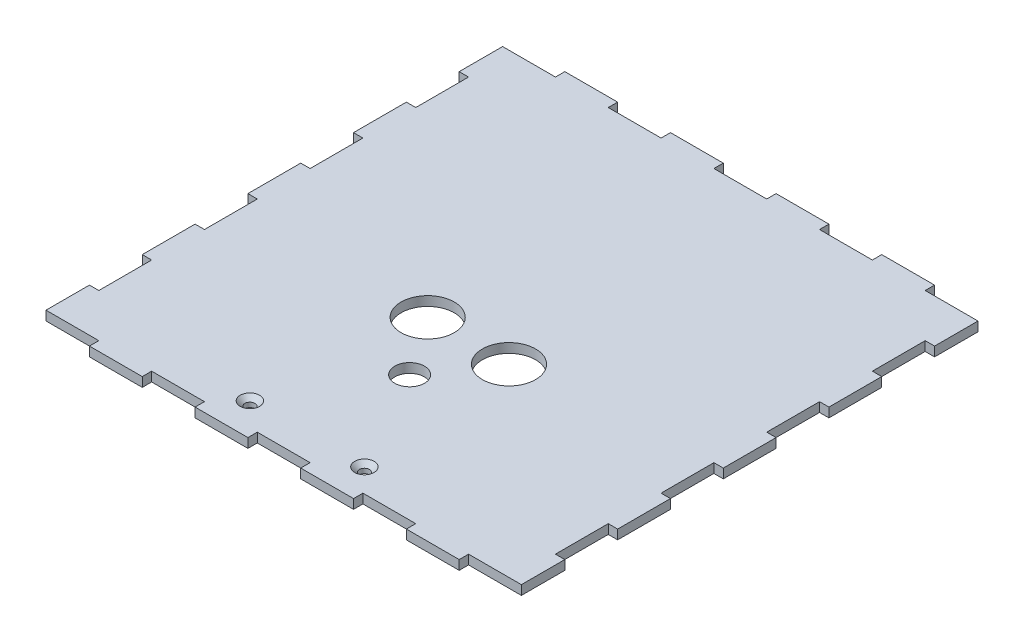
from build123d import *

# Parameters (mm, degrees)
BOSS_EXTRUDE1_DEPTH                      = 3
MIRROR1_AT_THE_SECOND_PLANE_COPY_1_DEPTH = 3
SKETCH2_R                                = 8.5
SKETCH2_R_2                              = 4.75
CUT_EXTRUDE1_DEPTH                       = 108.522090753
SKETCH3_R                                = 1.6
CUT_EXTRUDE2_DEPTH                       = 108.522090753
CHAMFER1_SIZE                            = 1.5


with BuildPart() as part:
    # Sketch1 → Boss-Extrude1 (new body)
    with BuildSketch(Plane(origin=(0, 0, 0), x_dir=(1, 0, 0), z_dir=(0, 1, 0))):
        Polygon((-76, -73), (-59.111111111, -73), (-59.111111111, -76), (-42.222222222, -76), (-42.222222222, -73), (-25.333333333, -73), (-25.333333333, -76), (-8.444444444, -76), (-8.444444444, -73), (0, -73), (0, 0), (-76, 0), (-76, -8.444444444), (-73, -8.444444444), (-73, -25.333333333), (-76, -25.333333333), (-76, -42.222222222), (-73, -42.222222222), (-73, -59.111111111), (-76, -59.111111111), align=None)
    boss_extrude1 = extrude(amount=BOSS_EXTRUDE1_DEPTH)



with BuildPart() as mirror1_1:
    # Mirror1: Boss-Extrude1 across plane
    add(boss_extrude1.mirror(Plane(origin=(0, 0, 0), x_dir=(0, 0, 1), z_dir=(1, 0, 0))))


with BuildPart() as part_1:
    add(part.part)

    add(mirror1_1.part)  # Mirror1 at the second plane merges Mirror1_1
    # Mirror1 at the second plane: Boss-Extrude1 across plane
    add(boss_extrude1.mirror(Plane.XY))

    # Mirror1 at the second plane copy 1 sketc → Mirror1 at the second plane copy 1 (add)
    with BuildSketch(Plane(origin=(0, 0, 0), x_dir=(-1, 0, 0), z_dir=(0, 1, 0))):
        Polygon((-76, -73), (-59.111111111, -73), (-59.111111111, -76), (-42.222222222, -76), (-42.222222222, -73), (-25.333333333, -73), (-25.333333333, -76), (-8.444444444, -76), (-8.444444444, -73), (0, -73), (0, 0), (-76, 0), (-76, -8.444444444), (-73, -8.444444444), (-73, -25.333333333), (-76, -25.333333333), (-76, -42.222222222), (-73, -42.222222222), (-73, -59.111111111), (-76, -59.111111111), align=None)
    extrude(amount=MIRROR1_AT_THE_SECOND_PLANE_COPY_1_DEPTH)

    # Sketch2 → Cut-Extrude1 (cut, through all)
    with BuildSketch(Plane(origin=(0, 3, 0), x_dir=(1, 0, 0), z_dir=(0, 1, 0))):
        with Locations(Location((-13, -13.96, 0), (0, 0, 270))):
            Circle(SKETCH2_R)
        with Locations(Location((13, -13.96, 0), (0, 0, 270))):
            Circle(SKETCH2_R)
        with Locations(Location((0, -32.73, 0), (0, 0, 270))):
            Circle(SKETCH2_R_2)
    extrude(amount=-CUT_EXTRUDE1_DEPTH, mode=Mode.SUBTRACT)

    # Sketch3 → Cut-Extrude2 (cut, through all)
    with BuildSketch(Plane(origin=(0, 3, 0), x_dir=(1, 0, 0), z_dir=(0, 1, 0))):
        with Locations(Location((-18.3, -65.5, 0), (0, 0, 270))):
            Circle(SKETCH3_R)
        with Locations(Location((18.3, -65.5, 0), (0, 0, 270))):
            Circle(SKETCH3_R)
    extrude(amount=-CUT_EXTRUDE2_DEPTH, mode=Mode.SUBTRACT)

    # Chamfer1
    chamfer1_edges = [part_1.edges().sort_by_distance(p)[0] for p in [
        (-18.3, 3, 63.9),
        (18.3, 3, 63.9),
    ]]
    chamfer(chamfer1_edges, length=CHAMFER1_SIZE)


solid = part_1.part
